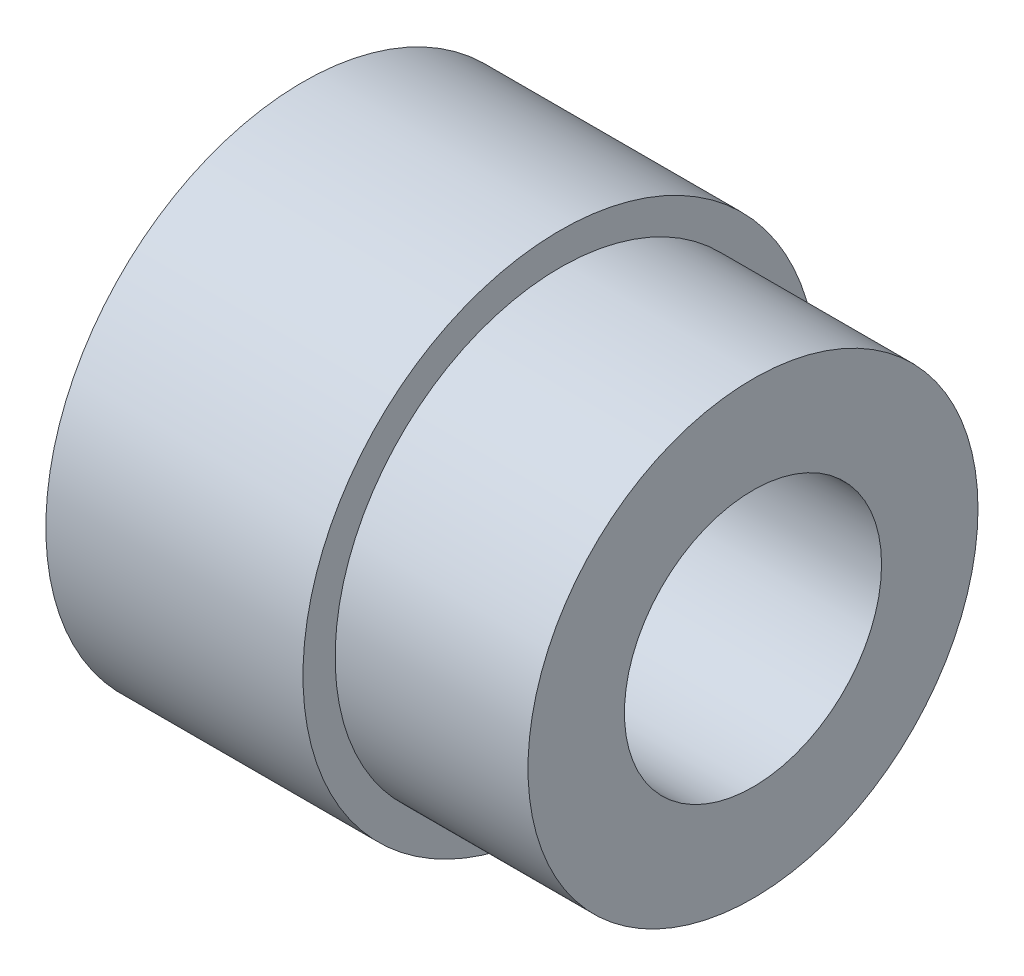
from build123d import *

# Parameters (mm, degrees)
SKETCH1_R           = 2
BOSS_EXTRUDE1_DEPTH = 2
SKETCH2_R           = 1.75
BOSS_EXTRUDE2_DEPTH = 1.5
SKETCH3_R           = 1
CUT_EXTRUDE1_DEPTH  = 11.5


with BuildPart() as part:
    # Sketch1 → Boss-Extrude1 (new body)
    with BuildSketch(Plane(origin=(0, 0, 0), x_dir=(0, 0, -1), z_dir=(1, 0, 0))):
        Circle(SKETCH1_R)
    extrude(amount=BOSS_EXTRUDE1_DEPTH)

    # Sketch2 → Boss-Extrude2 (add)
    with BuildSketch(Plane(origin=(2, 0, 0), x_dir=(0, 0, -1), z_dir=(1, 0, 0))):
        Circle(SKETCH2_R)
    extrude(amount=BOSS_EXTRUDE2_DEPTH)

    # Sketch3 → Cut-Extrude1 (cut)
    with BuildSketch(Plane(origin=(3.5, 0, 0), x_dir=(0, 0, -1), z_dir=(1, 0, 0))):
        Circle(SKETCH3_R)
    extrude(amount=-CUT_EXTRUDE1_DEPTH, mode=Mode.SUBTRACT)


solid = part.part
